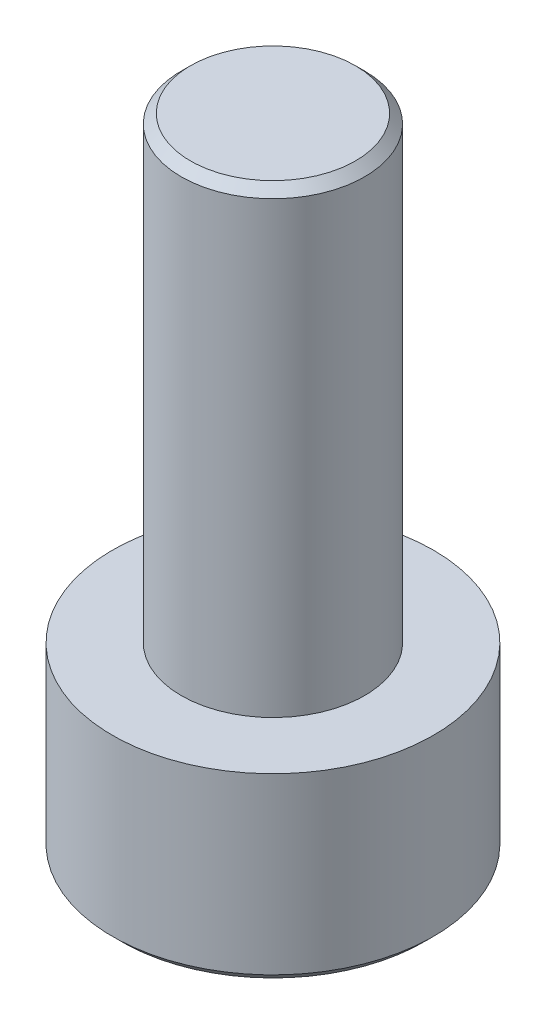
from build123d import *

# Parameters (mm, degrees)
SIMPLIFIED_START                    = -4
SIMPLIFIED_NOMINAL_HEX_SOCKET_DEPTH = 2


with BuildPart() as part:
    # Reconstructed nominal axial profile → Native revolved geometry (revolve)
    with BuildSketch(Plane.XY, mode=Mode.PRIVATE) as native_revolved_geometry_sk:
        Polygon((0, -4), (3.3, -4), (3.5, -3.8), (3.5, 0), (2, 0), (2, 9.8), (1.8, 10), (0, 10), align=None)
    revolve(native_revolved_geometry_sk.sketch.rotate(Axis((0, -500, 0), (0, 1, 0)), 90), axis=Axis((0, -500, 0), (0, 1, 0)))

    # Sketch2 → Simplified nominal hex socket (cut)
    with BuildSketch(Plane(origin=(0, 0, 0), x_dir=(1, 0, 0), z_dir=(0, 1, 0)).offset(SIMPLIFIED_START)):
        Polygon((1.732050808, 0), (0.866025404, -1.5), (-0.866025404, -1.5), (-1.732050808, 0), (-0.866025404, 1.5), (0.866025404, 1.5), align=None)
    extrude(amount=SIMPLIFIED_NOMINAL_HEX_SOCKET_DEPTH, mode=Mode.SUBTRACT)


solid = part.part
